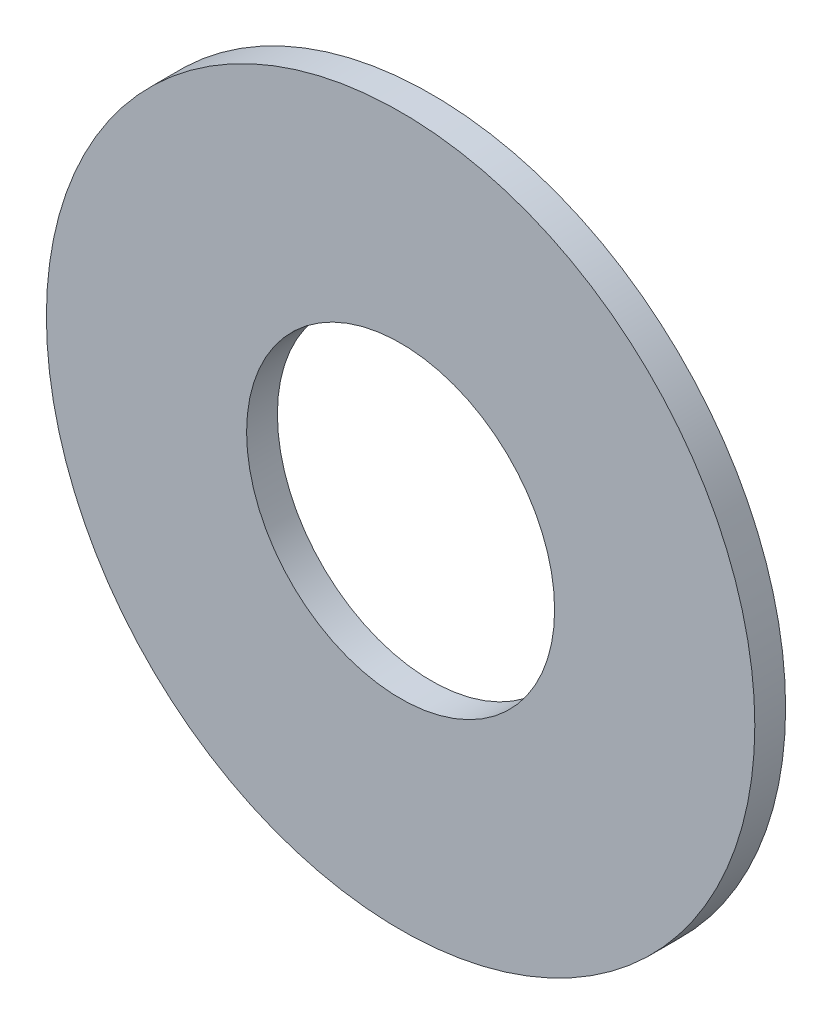
from build123d import *

# Parameters (mm, degrees)
SKETCH1_R           = 29.21
SKETCH1_R_2         = 12.7
BOSS_EXTRUDE1_DEPTH = 2.54


with BuildPart() as part:
    # Sketch1 → Boss-Extrude1 (new body)
    with BuildSketch(Plane.XY):
        Circle(SKETCH1_R)
        Circle(SKETCH1_R_2, mode=Mode.SUBTRACT)
    extrude(amount=BOSS_EXTRUDE1_DEPTH)


solid = part.part
